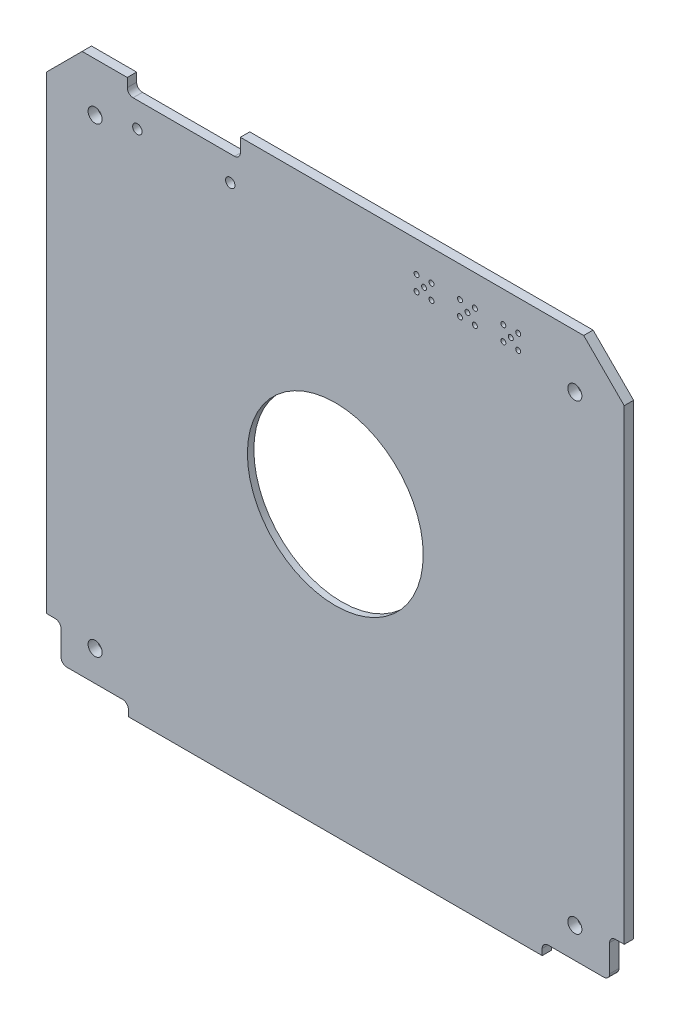
from build123d import *

# Parameters (mm, degrees)
SKETCH1_W             = 98.6
SKETCH1_H             = 95.18
BOSS_EXTRUDE1_DEPTH   = 1.6
HOLE1_D               = 0.85
HOLE2_D               = 0.85
HOLE3_D               = 0.85
HOLE4_D               = 0.85
HOLE5_D               = 0.85
HOLE6_D               = 0.85
HOLE7_D               = 0.85
HOLE8_D               = 0.85
HOLE9_D               = 0.85
HOLE10_D              = 0.85
HOLE11_D              = 0.85
HOLE12_D              = 0.85
HOLE13_D              = 0.85
HOLE14_D              = 0.85
HOLE15_D              = 0.85
HOLE16_D              = 1.6
HOLE17_D              = 1.6
F_2_CLEARANCE_HOLE1_D = 2.4
F_2_CLEARANCE_HOLE2_D = 2.4
F_2_CLEARANCE_HOLE3_D = 2.4
F_2_CLEARANCE_HOLE4_D = 2.4
CUT_EXTRUDE1_REACH    = 71.563
SKETCH44_R            = 38.5
HOLE18_D              = 30
HOLE18_DEPTH          = 1.6
CUT_EXTRUDE2_REACH    = 107.373
SKETCH47_W            = 14
SKETCH47_H            = 1.6
CUT_EXTRUDE3_REACH    = 109.912
SKETCH48_W            = 6.6
SKETCH48_H            = 1.6
CUT_EXTRUDE4_REACH    = 109.912
SKETCH49_W            = 1.6
SKETCH49_H            = 8.265
CUT_EXTRUDE5_REACH    = 107.373
SKETCH50_W            = 11.5
SKETCH50_H            = 1.6
CUT_EXTRUDE6_REACH    = 108.479
SKETCH51_W            = 33.099999986
SKETCH51_H            = 1.6
CUT_EXTRUDE7_REACH    = 106.27
SKETCH52_W            = 19.300000003
SKETCH52_H            = 1.6
CHAMFER1_SIZE         = 6.915
CHAMFER2_SIZE         = 6.1
FILLET1_R             = 1


with BuildPart() as part:
    # Sketch1 → Boss-Extrude1 (new body)
    with BuildSketch(Plane(origin=(0, 0, -0.0125), x_dir=(-1, 0, 0), z_dir=(0, 0, -1))):
        with Locations((0, -1.475)):
            Rectangle(SKETCH1_W, SKETCH1_H)
    extrude(amount=-BOSS_EXTRUDE1_DEPTH)

    # Hole1 (through all)
    with Locations(Plane(origin=(0, 0, -0.0125), x_dir=(-1, 0, 0), z_dir=(0, 0, -1))):
        with Locations((-31.21, 40.87)):
            Hole(HOLE1_D / 2)

    # Hole2 (through all)
    with Locations(Plane(origin=(0, 0, -0.0125), x_dir=(-1, 0, 0), z_dir=(0, 0, -1))):
        with Locations((-28.67, 40.87)):
            Hole(HOLE2_D / 2)

    # Hole3 (through all)
    with Locations(Plane(origin=(0, 0, -0.0125), x_dir=(-1, 0, 0), z_dir=(0, 0, -1))):
        with Locations((-29.94, 39.6)):
            Hole(HOLE3_D / 2)

    # Hole4 (through all)
    with Locations(Plane(origin=(0, 0, -0.0125), x_dir=(-1, 0, 0), z_dir=(0, 0, -1))):
        with Locations((-31.21, 38.33)):
            Hole(HOLE4_D / 2)

    # Hole5 (through all)
    with Locations(Plane(origin=(0, 0, -0.0125), x_dir=(-1, 0, 0), z_dir=(0, 0, -1))):
        with Locations((-28.67, 38.33)):
            Hole(HOLE5_D / 2)

    # Hole6 (through all)
    with Locations(Plane(origin=(0, 0, -0.0125), x_dir=(-1, 0, 0), z_dir=(0, 0, -1))):
        with Locations((-23.81, 40.87)):
            Hole(HOLE6_D / 2)

    # Hole7 (through all)
    with Locations(Plane(origin=(0, 0, -0.0125), x_dir=(-1, 0, 0), z_dir=(0, 0, -1))):
        with Locations((-21.27, 40.87)):
            Hole(HOLE7_D / 2)

    # Hole8 (through all)
    with Locations(Plane(origin=(0, 0, -0.0125), x_dir=(-1, 0, 0), z_dir=(0, 0, -1))):
        with Locations((-22.54, 39.6)):
            Hole(HOLE8_D / 2)

    # Hole9 (through all)
    with Locations(Plane(origin=(0, 0, -0.0125), x_dir=(-1, 0, 0), z_dir=(0, 0, -1))):
        with Locations((-23.81, 38.33)):
            Hole(HOLE9_D / 2)

    # Hole10 (through all)
    with Locations(Plane(origin=(0, 0, -0.0125), x_dir=(-1, 0, 0), z_dir=(0, 0, -1))):
        with Locations((-21.27, 38.33)):
            Hole(HOLE10_D / 2)

    # Hole11 (through all)
    with Locations(Plane(origin=(0, 0, -0.0125), x_dir=(-1, 0, 0), z_dir=(0, 0, -1))):
        with Locations((-16.41, 40.87)):
            Hole(HOLE11_D / 2)

    # Hole12 (through all)
    with Locations(Plane(origin=(0, 0, -0.0125), x_dir=(-1, 0, 0), z_dir=(0, 0, -1))):
        with Locations((-13.87, 40.87)):
            Hole(HOLE12_D / 2)

    # Hole13 (through all)
    with Locations(Plane(origin=(0, 0, -0.0125), x_dir=(-1, 0, 0), z_dir=(0, 0, -1))):
        with Locations((-15.14, 39.6)):
            Hole(HOLE13_D / 2)

    # Hole14 (through all)
    with Locations(Plane(origin=(0, 0, -0.0125), x_dir=(-1, 0, 0), z_dir=(0, 0, -1))):
        with Locations((-16.41, 38.33)):
            Hole(HOLE14_D / 2)

    # Hole15 (through all)
    with Locations(Plane(origin=(0, 0, -0.0125), x_dir=(-1, 0, 0), z_dir=(0, 0, -1))):
        with Locations((-13.87, 38.33)):
            Hole(HOLE15_D / 2)

    # Hole16 (through all)
    with Locations(Plane(origin=(0, 0, -0.0125), x_dir=(-1, 0, 0), z_dir=(0, 0, -1))):
        with Locations((17.925000017, 38.540000432)):
            Hole(HOLE16_D / 2)

    # Hole17 (through all)
    with Locations(Plane(origin=(0, 0, -0.0125), x_dir=(-1, 0, 0), z_dir=(0, 0, -1))):
        with Locations((33.775000017, 38.540000432)):
            Hole(HOLE17_D / 2)

    # #2 Clearance Hole1 (through all)
    with Locations(Plane(origin=(0, 0, -0.0125), x_dir=(-1, 0, 0), z_dir=(0, 0, -1))):
        with Locations((40.986176345, 36.992583135)):
            Hole(F_2_CLEARANCE_HOLE1_D / 2)

    # #2 Clearance Hole2 (through all)
    with Locations(Plane(origin=(0, 0, -0.0125), x_dir=(-1, 0, 0), z_dir=(0, 0, -1))):
        with Locations((-40.872805953, 36.992583135)):
            Hole(F_2_CLEARANCE_HOLE2_D / 2)

    # #2 Clearance Hole3 (through all)
    with Locations(Plane(origin=(0, 0, -0.0125), x_dir=(-1, 0, 0), z_dir=(0, 0, -1))):
        with Locations((-40.872805953, -41.802159184)):
            Hole(F_2_CLEARANCE_HOLE3_D / 2)

    # #2 Clearance Hole4 (through all)
    with Locations(Plane(origin=(0, 0, -0.0125), x_dir=(-1, 0, 0), z_dir=(0, 0, -1))):
        with Locations((40.986176345, -41.802159184)):
            Hole(F_2_CLEARANCE_HOLE4_D / 2)

    # Sketch44 → Cut-Extrude1 (cut, up to next)
    with BuildSketch(Plane.XY.offset(0.4875), mode=Mode.PRIVATE) as cut_extrude1_sk1:
        with Locations(Location((0, 0, 0), (0, 0, 180))):
            Circle(SKETCH44_R)
    cut_extrude1_tool1 = extrude(cut_extrude1_sk1.sketch, amount=-CUT_EXTRUDE1_REACH, mode=Mode.PRIVATE) & part.part
    add(cut_extrude1_tool1.solids().sort_by_distance((0, 0, 0.4875))[0], mode=Mode.SUBTRACT)

    # Hole18
    with Locations(Plane.XY.offset(1.5875)):
        with Locations((0, 0)):
            Hole(HOLE18_D / 2, depth=HOLE18_DEPTH)

    # Sketch47 → Cut-Extrude2 (cut, up to next)
    with BuildSketch(Plane(origin=(0, -47, 0), x_dir=(1, 0, 0), z_dir=(0, 1, 0)), mode=Mode.PRIVATE) as cut_extrude2_sk1:
        with Locations((42.3, -0.7875)):
            Rectangle(SKETCH47_W, SKETCH47_H)
    cut_extrude2_tool1 = extrude(cut_extrude2_sk1.sketch, amount=-CUT_EXTRUDE2_REACH, mode=Mode.PRIVATE) & part.part
    add(cut_extrude2_tool1.solids().sort_by_distance((42.3, -47, 0.7875))[0], mode=Mode.SUBTRACT)

    # Sketch48 → Cut-Extrude3 (cut, up to next)
    with BuildSketch(Plane(origin=(46.8, 0, 0), x_dir=(0, -1, 0), z_dir=(-1, 0, 0)), mode=Mode.PRIVATE) as cut_extrude3_sk1:
        with Locations((43.7, 0.7875)):
            Rectangle(SKETCH48_W, SKETCH48_H)
    cut_extrude3_tool1 = extrude(cut_extrude3_sk1.sketch, amount=-CUT_EXTRUDE3_REACH, mode=Mode.PRIVATE) & part.part
    add(cut_extrude3_tool1.solids().sort_by_distance((46.8, -43.7, 0.7875))[0], mode=Mode.SUBTRACT)

    # Sketch49 → Cut-Extrude4 (cut, up to next)
    with BuildSketch(Plane(origin=(-46.8, 0, 0), x_dir=(0, 0, -1), z_dir=(1, 0, 0)), mode=Mode.PRIVATE) as cut_extrude4_sk1:
        with Locations((-0.7875, -44.9325)):
            Rectangle(SKETCH49_W, SKETCH49_H)
    cut_extrude4_tool1 = extrude(cut_extrude4_sk1.sketch, amount=-CUT_EXTRUDE4_REACH, mode=Mode.PRIVATE) & part.part
    add(cut_extrude4_tool1.solids().sort_by_distance((-46.8, -44.9325, 0.7875))[0], mode=Mode.SUBTRACT)

    # Sketch50 → Cut-Extrude5 (cut, up to next)
    with BuildSketch(Plane(origin=(0, -47, 0), x_dir=(1, 0, 0), z_dir=(0, 1, 0)), mode=Mode.PRIVATE) as cut_extrude5_sk1:
        with Locations((-41.05, -0.7875)):
            Rectangle(SKETCH50_W, SKETCH50_H)
    cut_extrude5_tool1 = extrude(cut_extrude5_sk1.sketch, amount=-CUT_EXTRUDE5_REACH, mode=Mode.PRIVATE) & part.part
    add(cut_extrude5_tool1.solids().sort_by_distance((-41.05, -47, 0.7875))[0], mode=Mode.SUBTRACT)

    # Sketch51 → Cut-Extrude6 (cut, up to next)
    with BuildSketch(Plane.XZ.offset(-45.3), mode=Mode.PRIVATE) as cut_extrude6_sk1:
        with Locations((-32.750000007, 0.7875)):
            Rectangle(SKETCH51_W, SKETCH51_H)
    cut_extrude6_tool1 = extrude(cut_extrude6_sk1.sketch, amount=-CUT_EXTRUDE6_REACH, mode=Mode.PRIVATE) & part.part
    add(cut_extrude6_tool1.solids().sort_by_distance((-32.75, 45.3, 0.7875))[0], mode=Mode.SUBTRACT)

    # Sketch52 → Cut-Extrude7 (cut, up to next)
    with BuildSketch(Plane.XZ.offset(-42.8), mode=Mode.PRIVATE) as cut_extrude7_sk1:
        with Locations((-25.850000016, 0.7875)):
            Rectangle(SKETCH52_W, SKETCH52_H)
    cut_extrude7_tool1 = extrude(cut_extrude7_sk1.sketch, amount=-CUT_EXTRUDE7_REACH, mode=Mode.PRIVATE) & part.part
    add(cut_extrude7_tool1.solids().sort_by_distance((-25.85, 42.8, 0.7875))[0], mode=Mode.SUBTRACT)

    # Chamfer1
    chamfer1_edges = [part.edges().sort_by_distance(p)[0] for p in [
        (49.3, 46.115, 0.7875),
    ]]
    chamfer(chamfer1_edges, length=CHAMFER1_SIZE)

    # Chamfer2
    chamfer2_edges = [part.edges().sort_by_distance(p)[0] for p in [
        (-49.3, 45.3, 0.7875),
    ]]
    chamfer(chamfer2_edges, length=CHAMFER2_SIZE)

    # Fillet1
    fillet1_edges = [part.edges().sort_by_distance(p)[0] for p in [
        (35.3, -47, 0.7875),
        (46.8, -47, 0.7875),
        (46.8, -40.4, 0.7875),
        (-46.8, -40.8, 0.7875),
        (-35.3, -47, 0.7875),
        (-46.8, -47, 0.7875),
        (-35.500000017, 42.8, 0.7875),
        (-16.200000014, 42.8, 0.7875),
    ]]
    fillet(fillet1_edges, radius=FILLET1_R)


solid = part.part
